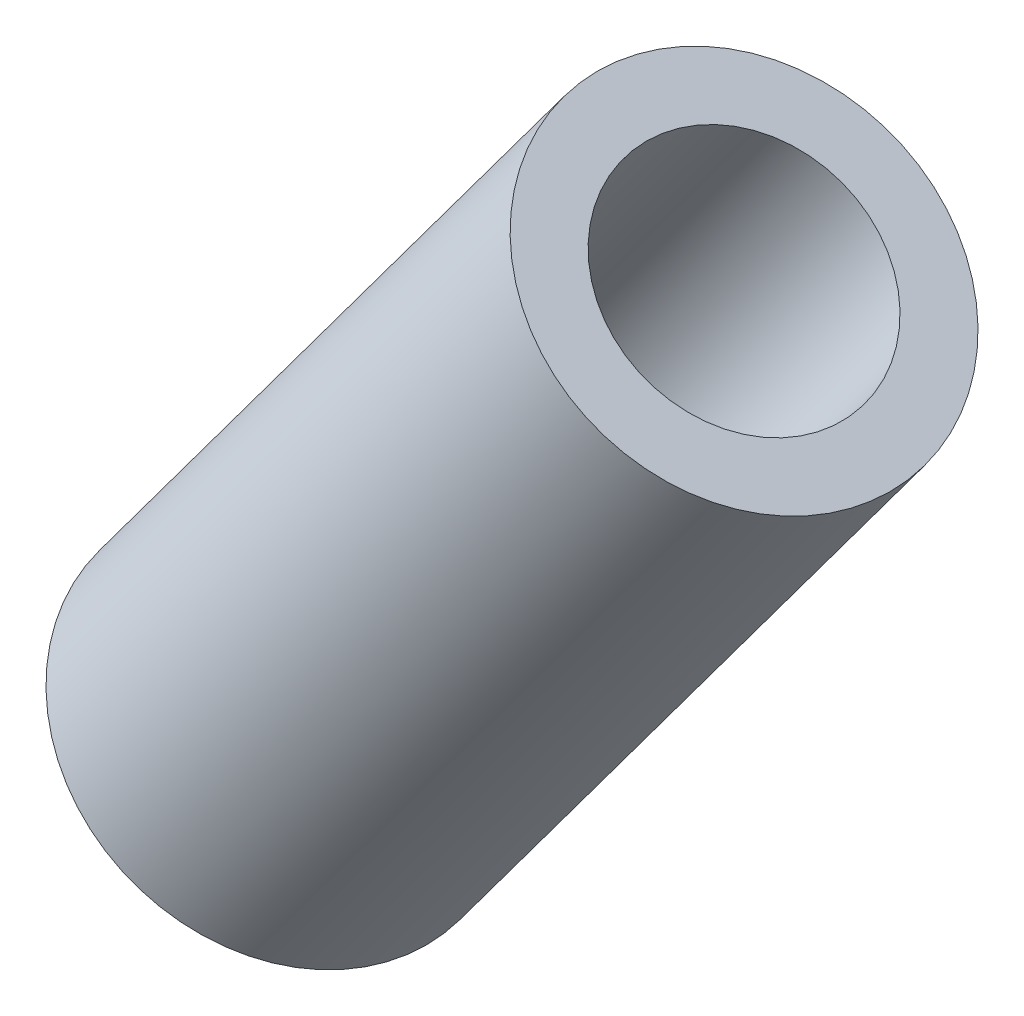
from build123d import *

# Parameters (mm, degrees)
SWEEP1_PROFILE_R     = 11.90625
CUT_SWEEP1_PROFILE_R = 7.9375


with BuildPart() as part:
    # Sweep1: sweep along a curve in space
    with BuildLine() as sweep1_path:
        Line((0, 0, 0), (30.290133782, 40.78170908, 0))
    # Sweep1 profile (on start of the path) → Sweep1 (sweep)
    with BuildSketch(Plane(origin=(0, 0, 0), x_dir=(0.8027895488189021, -0.5962624760180233, 0), z_dir=(0.5962624760180233, 0.8027895488189021, 0))):
        Circle(SWEEP1_PROFILE_R)
    sweep(path=sweep1_path.line)

    # Cut-Sweep1: sweep along a curve in space
    with BuildLine() as cut_sweep1_path:
        Line((0, 0, 0), (30.290133782, 40.78170908, 0))
    # Cut-Sweep1 profile (on start of the path) → Cut-Sweep1 (sweep, cut)
    with BuildSketch(Plane(origin=(0, 0, 0), x_dir=(0.8027895488189021, -0.5962624760180233, 0), z_dir=(0.5962624760180233, 0.8027895488189021, 0))):
        Circle(CUT_SWEEP1_PROFILE_R)
    sweep(path=cut_sweep1_path.line, mode=Mode.SUBTRACT)


solid = part.part
